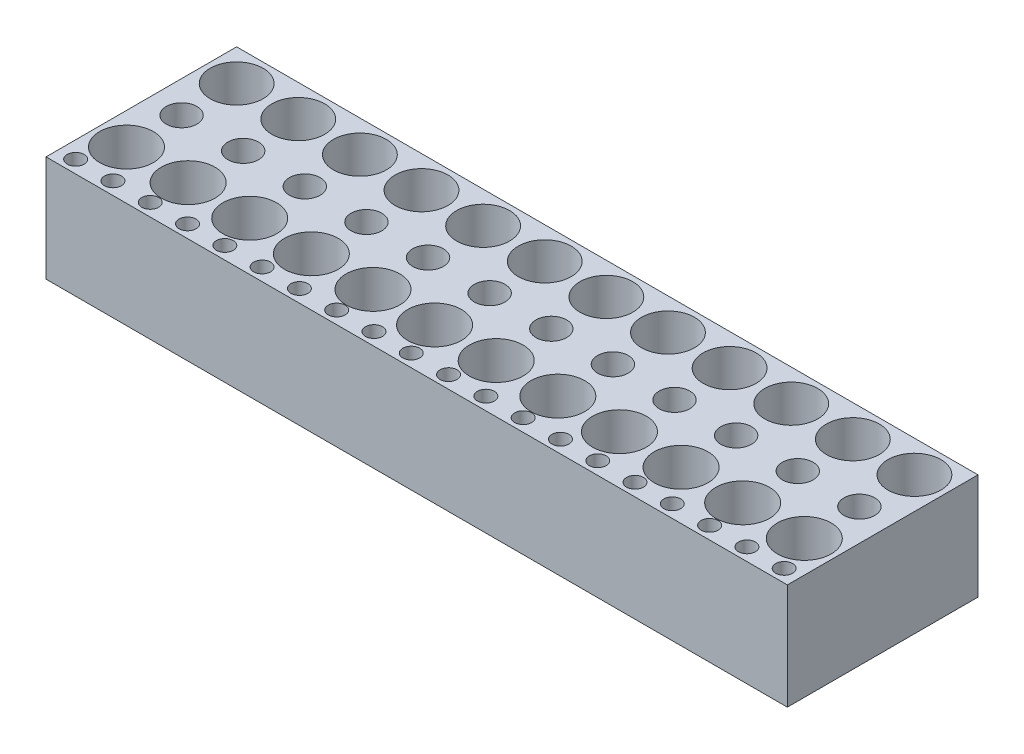
from build123d import *

# Parameters (mm, degrees)
SKETCH_1_W          = 35
SKETCH_1_H          = 9
EXTRUDE_1_DEPTH     = 5
SKETCH_2_R          = 1.25
SKETCH_2_R_2        = 0.725
SKETCH_2_R_3        = 1.27
SKETCH_2_R_4        = 0.4
CUT_EXTRUDE_1_DEPTH = 5


with BuildPart() as part:
    # 草图1 → 凸台-拉伸1 (new body)
    with BuildSketch(Plane(origin=(0, 0, 0), x_dir=(1, 0, 0), z_dir=(0, 1, 0))):
        Rectangle(SKETCH_1_W, SKETCH_1_H)
    extrude(amount=EXTRUDE_1_DEPTH)

    # 草图2 → 切除-拉伸1 (cut)
    with BuildSketch(Plane(origin=(0, 5, 0), x_dir=(1, 0, 0), z_dir=(0, 1, 0))):
        with Locations(Location((-16, 3, 0), (0, 0, 270))):
            Circle(SKETCH_2_R)
        with Locations(Location((-13.090909091, 3, 0), (0, 0, 270))):
            Circle(SKETCH_2_R)
        with Locations(Location((-10.181818182, 3, 0), (0, 0, 270))):
            Circle(SKETCH_2_R)
        with Locations(Location((-7.272727273, 3, 0), (0, 0, 270))):
            Circle(SKETCH_2_R)
        with Locations(Location((-4.363636364, 3, 0), (0, 0, 270))):
            Circle(SKETCH_2_R)
        with Locations(Location((-1.454545455, 3, 0), (0, 0, 270))):
            Circle(SKETCH_2_R)
        with Locations(Location((1.454545455, 3, 0), (0, 0, 270))):
            Circle(SKETCH_2_R)
        with Locations(Location((4.363636364, 3, 0), (0, 0, 270))):
            Circle(SKETCH_2_R)
        with Locations(Location((7.272727273, 3, 0), (0, 0, 270))):
            Circle(SKETCH_2_R)
        with Locations(Location((10.181818182, 3, 0), (0, 0, 270))):
            Circle(SKETCH_2_R)
        with Locations(Location((13.090909091, 3, 0), (0, 0, 270))):
            Circle(SKETCH_2_R)
        with Locations(Location((16, 3, 0), (0, 0, 270))):
            Circle(SKETCH_2_R)
        with Locations(Location((-16, 0.4, 0), (0, 0, 270))):
            Circle(SKETCH_2_R_2)
        with Locations(Location((-13.090909091, 0.4, 0), (0, 0, 270))):
            Circle(SKETCH_2_R_2)
        with Locations(Location((-10.181818182, 0.4, 0), (0, 0, 270))):
            Circle(SKETCH_2_R_2)
        with Locations(Location((-7.272727273, 0.4, 0), (0, 0, 270))):
            Circle(SKETCH_2_R_2)
        with Locations(Location((-4.363636364, 0.4, 0), (0, 0, 270))):
            Circle(SKETCH_2_R_2)
        with Locations(Location((-1.454545455, 0.4, 0), (0, 0, 270))):
            Circle(SKETCH_2_R_2)
        with Locations(Location((1.454545455, 0.4, 0), (0, 0, 270))):
            Circle(SKETCH_2_R_2)
        with Locations(Location((4.363636364, 0.4, 0), (0, 0, 270))):
            Circle(SKETCH_2_R_2)
        with Locations(Location((7.272727273, 0.4, 0), (0, 0, 270))):
            Circle(SKETCH_2_R_2)
        with Locations(Location((10.181818182, 0.4, 0), (0, 0, 270))):
            Circle(SKETCH_2_R_2)
        with Locations(Location((13.090909091, 0.4, 0), (0, 0, 270))):
            Circle(SKETCH_2_R_2)
        with Locations(Location((16, 0.4, 0), (0, 0, 270))):
            Circle(SKETCH_2_R_2)
        with Locations(Location((-16, -2.2, 0), (0, 0, 270))):
            Circle(SKETCH_2_R_3)
        with Locations(Location((-13.090909091, -2.2, 0), (0, 0, 270))):
            Circle(SKETCH_2_R_3)
        with Locations(Location((-10.181818182, -2.2, 0), (0, 0, 270))):
            Circle(SKETCH_2_R_3)
        with Locations(Location((-7.272727273, -2.2, 0), (0, 0, 270))):
            Circle(SKETCH_2_R_3)
        with Locations(Location((-4.363636364, -2.2, 0), (0, 0, 270))):
            Circle(SKETCH_2_R_3)
        with Locations(Location((-1.454545455, -2.2, 0), (0, 0, 270))):
            Circle(SKETCH_2_R_3)
        with Locations(Location((1.454545455, -2.2, 0), (0, 0, 270))):
            Circle(SKETCH_2_R_3)
        with Locations(Location((4.363636364, -2.2, 0), (0, 0, 270))):
            Circle(SKETCH_2_R_3)
        with Locations(Location((7.272727273, -2.2, 0), (0, 0, 270))):
            Circle(SKETCH_2_R_3)
        with Locations(Location((10.181818182, -2.2, 0), (0, 0, 270))):
            Circle(SKETCH_2_R_3)
        with Locations(Location((13.090909091, -2.2, 0), (0, 0, 270))):
            Circle(SKETCH_2_R_3)
        with Locations(Location((16, -2.2, 0), (0, 0, 270))):
            Circle(SKETCH_2_R_3)
        with Locations(Location((-16.7, -3.9, 0), (0, 0, 270))):
            Circle(SKETCH_2_R_4)
        with Locations(Location((-14.939473684, -3.9, 0), (0, 0, 270))):
            Circle(SKETCH_2_R_4)
        with Locations(Location((-13.178947368, -3.9, 0), (0, 0, 270))):
            Circle(SKETCH_2_R_4)
        with Locations(Location((-11.418421053, -3.9, 0), (0, 0, 270))):
            Circle(SKETCH_2_R_4)
        with Locations(Location((-9.657894737, -3.9, 0), (0, 0, 270))):
            Circle(SKETCH_2_R_4)
        with Locations(Location((-7.897368421, -3.9, 0), (0, 0, 270))):
            Circle(SKETCH_2_R_4)
        with Locations(Location((-6.136842105, -3.9, 0), (0, 0, 270))):
            Circle(SKETCH_2_R_4)
        with Locations(Location((-4.376315789, -3.9, 0), (0, 0, 270))):
            Circle(SKETCH_2_R_4)
        with Locations(Location((-2.615789474, -3.9, 0), (0, 0, 270))):
            Circle(SKETCH_2_R_4)
        with Locations(Location((-0.855263158, -3.9, 0), (0, 0, 270))):
            Circle(SKETCH_2_R_4)
        with Locations(Location((0.905263158, -3.9, 0), (0, 0, 270))):
            Circle(SKETCH_2_R_4)
        with Locations(Location((2.665789474, -3.9, 0), (0, 0, 270))):
            Circle(SKETCH_2_R_4)
        with Locations(Location((4.426315789, -3.9, 0), (0, 0, 270))):
            Circle(SKETCH_2_R_4)
        with Locations(Location((6.186842105, -3.9, 0), (0, 0, 270))):
            Circle(SKETCH_2_R_4)
        with Locations(Location((7.947368421, -3.9, 0), (0, 0, 270))):
            Circle(SKETCH_2_R_4)
        with Locations(Location((9.707894737, -3.9, 0), (0, 0, 270))):
            Circle(SKETCH_2_R_4)
        with Locations(Location((11.468421053, -3.9, 0), (0, 0, 270))):
            Circle(SKETCH_2_R_4)
        with Locations(Location((13.228947368, -3.9, 0), (0, 0, 270))):
            Circle(SKETCH_2_R_4)
        with Locations(Location((14.989473684, -3.9, 0), (0, 0, 270))):
            Circle(SKETCH_2_R_4)
        with Locations(Location((16.75, -3.9, 0), (0, 0, 270))):
            Circle(SKETCH_2_R_4)
    extrude(amount=-CUT_EXTRUDE_1_DEPTH, mode=Mode.SUBTRACT)


solid = part.part
